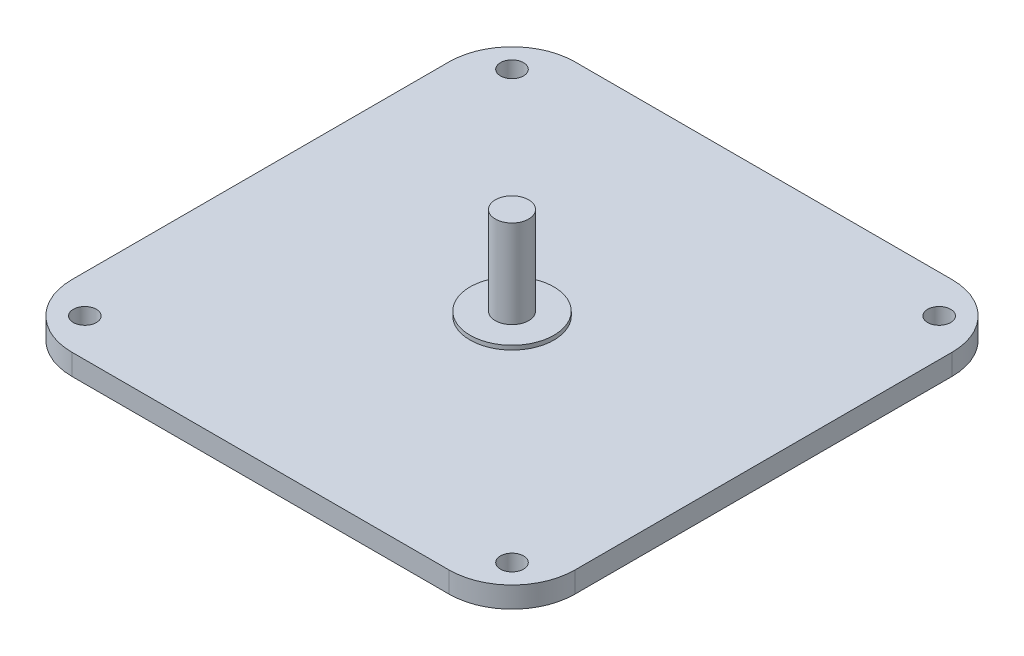
from build123d import *

# Parameters (mm, degrees)
ESBO_O1_W                = 120
ESBO_O1_H                = 120
ESBO_O1_R                = 2.75
RESSALTO_EXTRUS_O1_DEPTH = 2.5
FILETE1_R                = 15
ESBO_O2_R                = 3.975
RESSALTO_EXTRUS_O2_DEPTH = 22
ESBO_O3_R                = 10
RESSALTO_EXTRUS_O3_DEPTH = 1


with BuildPart() as part:
    # Esboço1 → Ressalto-extrusão1 (new, symmetric)
    with BuildSketch(Plane(origin=(0, 0, 0), x_dir=(1, 0, 0), z_dir=(0, 1, 0))):
        Rectangle(ESBO_O1_W, ESBO_O1_H)
        with Locations(Location((-50.955395397, -50.955395397, 0), (0, 0, 270))):
            Circle(ESBO_O1_R, mode=Mode.SUBTRACT)
        with Locations(Location((-50.955395397, 50.955395397, 0), (0, 0, 270))):
            Circle(ESBO_O1_R, mode=Mode.SUBTRACT)
        with Locations(Location((50.955395397, 50.955395397, 0), (0, 0, 270))):
            Circle(ESBO_O1_R, mode=Mode.SUBTRACT)
        with Locations(Location((50.955395397, -50.955395397, 0), (0, 0, 270))):
            Circle(ESBO_O1_R, mode=Mode.SUBTRACT)
    extrude(amount=RESSALTO_EXTRUS_O1_DEPTH, both=True)

    # Filete1
    filete1_edges = [part.edges().sort_by_distance(p)[0] for p in [
        (-60, 0, 60),
        (-60, 0, -60),
        (60, 0, -60),
        (60, 0, 60),
    ]]
    fillet(filete1_edges, radius=FILETE1_R)

    # Esboço2 → Ressalto-extrusão2 (add)
    with BuildSketch(Plane(origin=(0, 2.5, 0), x_dir=(1, 0, 0), z_dir=(0, 1, 0))):
        with Locations(Location((0, 0, 0), (0, 0, 270))):
            Circle(ESBO_O2_R)
    extrude(amount=RESSALTO_EXTRUS_O2_DEPTH)

    # Esboço3 → Ressalto-extrusão3 (add)
    with BuildSketch(Plane(origin=(0, 2.5, 0), x_dir=(1, 0, 0), z_dir=(0, 1, 0))):
        with Locations(Location((0, 0, 0), (0, 0, 270))):
            Circle(ESBO_O3_R)
    extrude(amount=RESSALTO_EXTRUS_O3_DEPTH)


solid = part.part
